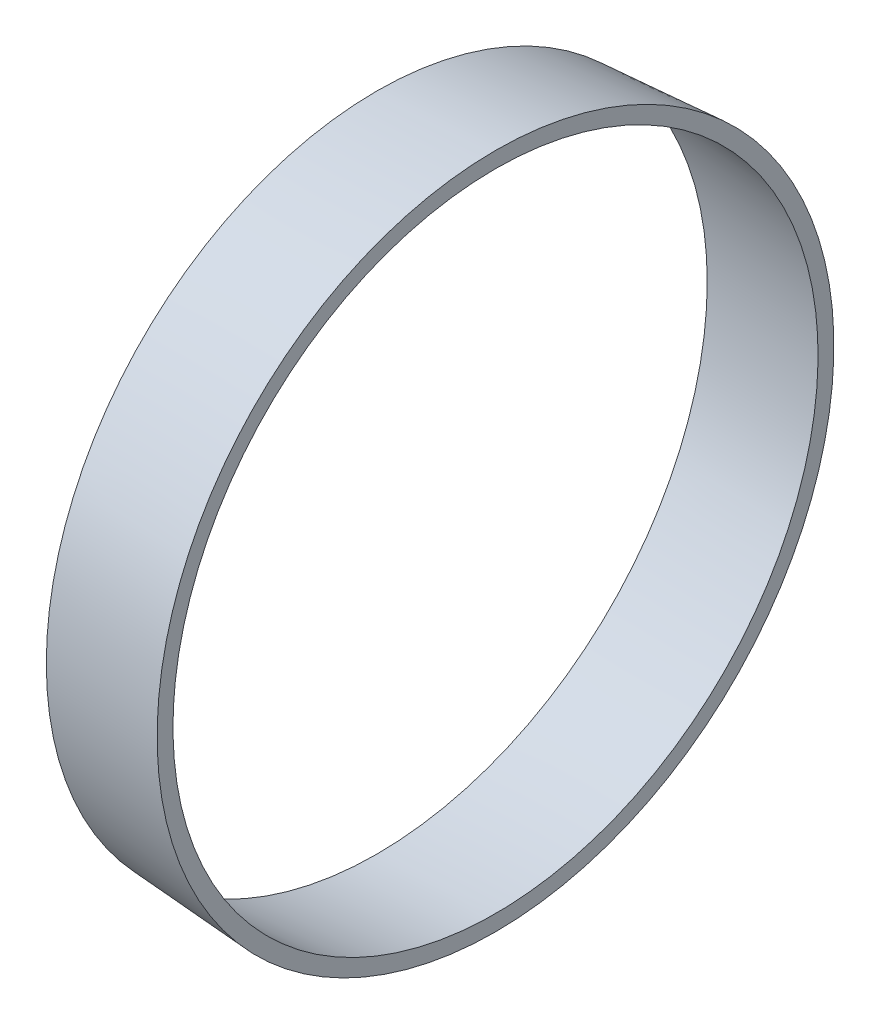
from build123d import *

# Parameters (mm, degrees)
REVOLVE1_ANGLE = 359.999999589


with BuildPart() as part:
    # Sketch1 → Revolve1 (revolve)
    with BuildSketch(Plane.XY):
        Polygon((100, 1670), (700, 1710), (700, 1630), align=None)
    revolve(axis=Axis((0, 0, 0), (1, 0, 0)), revolution_arc=REVOLVE1_ANGLE)


solid = part.part
